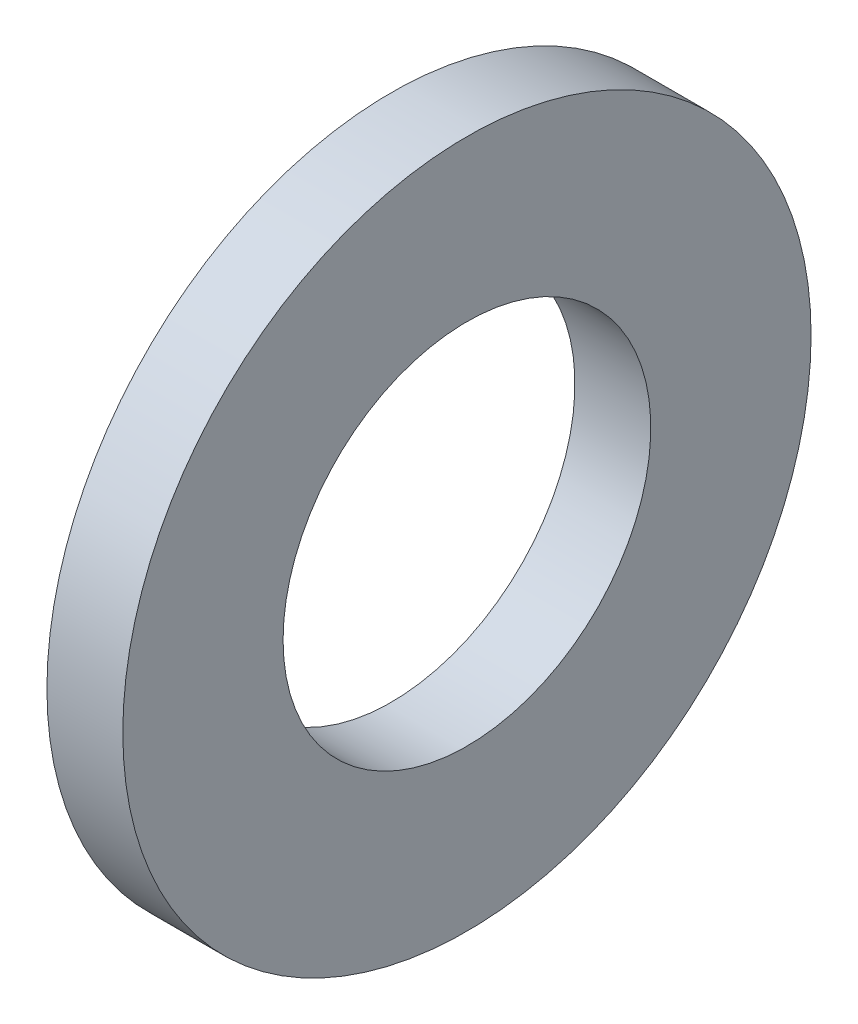
from build123d import *

# Parameters (mm, degrees)
SKETCH1_W = 2.8
SKETCH1_H = 5.915


with BuildPart() as part:
    # Sketch1 → Base-Revolve (revolve)
    with BuildSketch(Plane.XY, mode=Mode.PRIVATE) as base_revolve_sk:
        with Locations((-1.4, 9.7425)):
            Rectangle(SKETCH1_W, SKETCH1_H)
    revolve(base_revolve_sk.sketch.rotate(Axis((-34.925, 0, 0), (1, 0, 0)), 90), axis=Axis((-34.925, 0, 0), (1, 0, 0)))


solid = part.part
